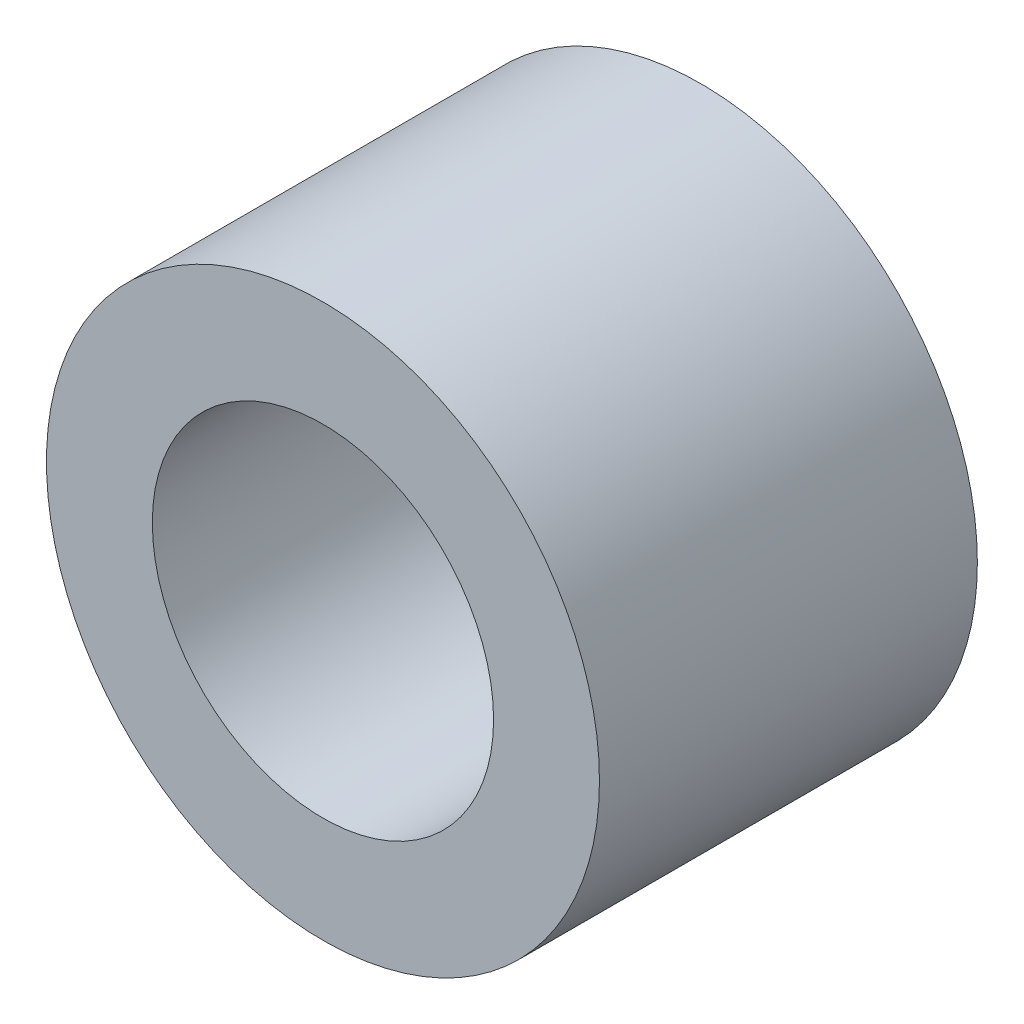
from build123d import *

# Parameters (mm, degrees)
SKETCH1_R           = 20.2565
SKETCH1_R_2         = 12.499975
BOSS_EXTRUDE1_DEPTH = 27.686
SHELL1_T            = -0.254
SKETCH2_R           = 12.499975
BOSS_EXTRUDE2_DEPTH = 0.254
BOSS_EXTRUDE3_START = -0.254
SKETCH3_R           = 20.0025
SKETCH3_R_2         = 12.753975
BOSS_EXTRUDE3_DEPTH = 0.254


with BuildPart() as part:
    # Sketch1 → Boss-Extrude1 (new body)
    with BuildSketch(Plane.XY):
        Circle(SKETCH1_R)
        Circle(SKETCH1_R_2, mode=Mode.SUBTRACT)
    extrude(amount=BOSS_EXTRUDE1_DEPTH)

    # Shell1
    shell1_openings = [part.faces().sort_by_distance(p)[0] for p in [
        (-19.683559659, 0, 27.686),
    ]]
    offset(amount=SHELL1_T, openings=shell1_openings, kind=Kind.INTERSECTION)

    # Sketch2 → Boss-Extrude2 (add)
    with BuildSketch(Plane(origin=(0, 0, 0), x_dir=(-1, 0, 0), z_dir=(0, 0, -1))):
        Circle(SKETCH2_R)
    extrude(amount=-BOSS_EXTRUDE2_DEPTH)

    # Sketch3 → Boss-Extrude3 (add)
    with BuildSketch(Plane.XY.offset(27.686).offset(BOSS_EXTRUDE3_START)):
        Circle(SKETCH3_R)
        Circle(SKETCH3_R_2, mode=Mode.SUBTRACT)
    extrude(amount=BOSS_EXTRUDE3_DEPTH)


solid = part.part
